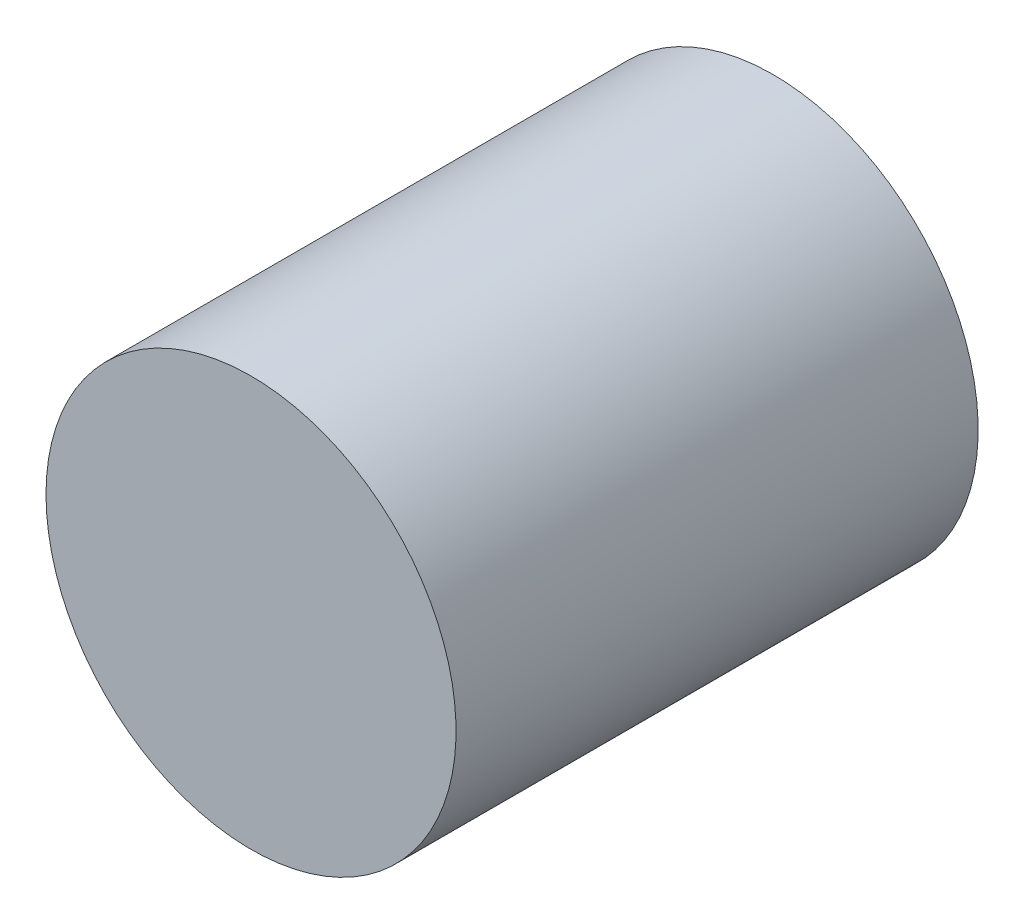
from build123d import *

# Parameters (mm, degrees)
SKETCH_1_R      = 47.120661972
EXTRUDE_1_DEPTH = 120


with BuildPart() as part:
    # 草图1 → 凸台-拉伸1 (new body)
    with BuildSketch(Plane.XY):
        with Locations(Location((0, 0, 0), (0, 0, 180))):
            Circle(SKETCH_1_R)
    extrude(amount=EXTRUDE_1_DEPTH)


solid = part.part
